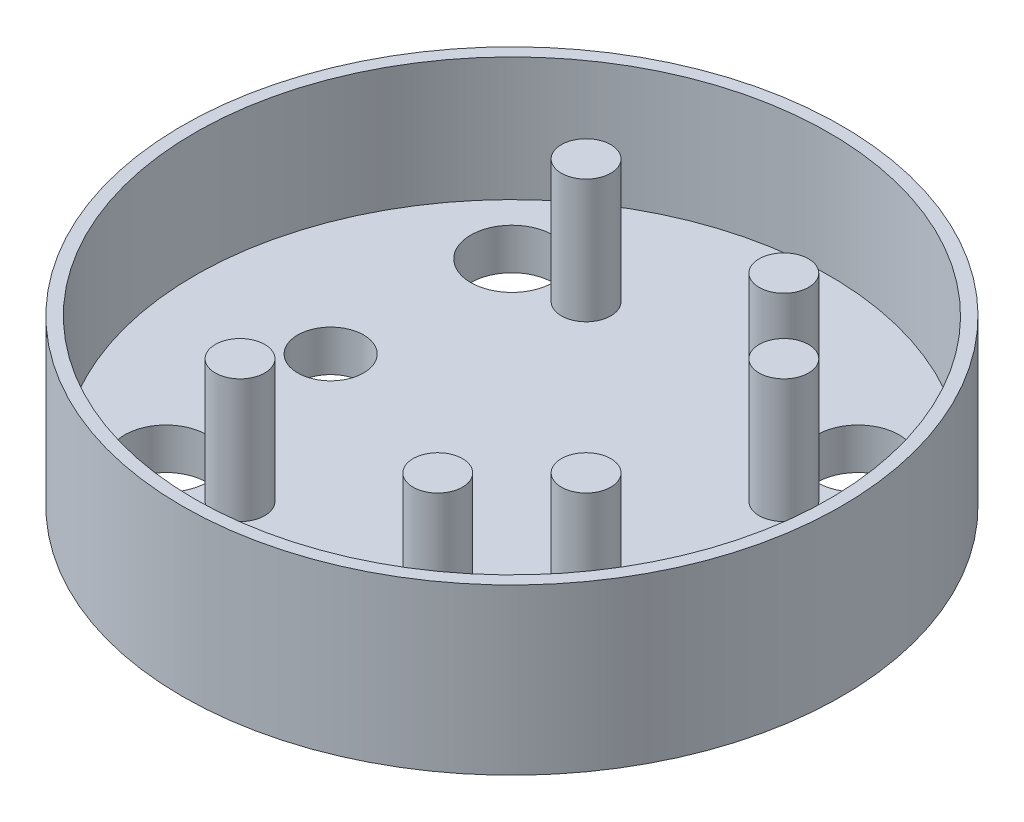
from build123d import *

# Parameters (mm, degrees)
SKETCH1_R           = 40
SKETCH1_R_2         = 5
BOSS_EXTRUDE1_DEPTH = 5
SKETCH2_R           = 40
SKETCH2_R_2         = 38.5
SKETCH2_R_3         = 3
BOSS_EXTRUDE2_DEPTH = 15
SKETCH5_R           = 4
CUT_EXTRUDE1_DEPTH  = 5


with BuildPart() as part:
    # Sketch1 → Boss-Extrude1 (new body)
    with BuildSketch(Plane(origin=(0, 0, 0), x_dir=(1, 0, 0), z_dir=(0, 1, 0))):
        with Locations(Location((0, 0, 0), (0, 0, 270))):
            Circle(SKETCH1_R)
        with Locations(Location((-21, 21, 0), (0, 0, 270))):
            Circle(SKETCH1_R_2, mode=Mode.SUBTRACT)
        with Locations(Location((-21, -21, 0), (0, 0, 270))):
            Circle(SKETCH1_R_2, mode=Mode.SUBTRACT)
        with Locations(Location((21, -21, 0), (0, 0, 270))):
            Circle(SKETCH1_R_2, mode=Mode.SUBTRACT)
        with Locations(Location((21, 21, 0), (0, 0, 270))):
            Circle(SKETCH1_R_2, mode=Mode.SUBTRACT)
    extrude(amount=BOSS_EXTRUDE1_DEPTH)

    # Sketch2 → Boss-Extrude2 (add)
    # profile 1 of 7: a face of its own
    with BuildSketch(Plane(origin=(0, 5, 0), x_dir=(1, 0, 0), z_dir=(0, 1, 0))):
        with Locations(Location((0, 0, 0), (0, 0, 270))):
            Circle(SKETCH2_R)
        with Locations(Location((0, 0, 0), (0, 0, 270))):
            Circle(SKETCH2_R_2, mode=Mode.SUBTRACT)
    # profile 2 of 7: a face of its own
    with BuildSketch(Plane(origin=(0, 5, 0), x_dir=(1, 0, 0), z_dir=(0, 1, 0))):
        with Locations(Location((-12, -21, 0), (0, 0, 270))):
            Circle(SKETCH2_R_3)
    # profile 3 of 7: a face of its own
    with BuildSketch(Plane(origin=(0, 5, 0), x_dir=(1, 0, 0), z_dir=(0, 1, 0))):
        with Locations(Location((12, -21, 0), (0, 0, 270))):
            Circle(SKETCH2_R_3)
    # profile 4 of 7: a face of its own
    with BuildSketch(Plane(origin=(0, 5, 0), x_dir=(1, 0, 0), z_dir=(0, 1, 0))):
        with Locations(Location((21, -12, 0), (0, 0, 270))):
            Circle(SKETCH2_R_3)
    # profile 5 of 7: a face of its own
    with BuildSketch(Plane(origin=(0, 5, 0), x_dir=(1, 0, 0), z_dir=(0, 1, 0))):
        with Locations(Location((21, 12, 0), (0, 0, 270))):
            Circle(SKETCH2_R_3)
    # profile 6 of 7: a face of its own
    with BuildSketch(Plane(origin=(0, 5, 0), x_dir=(1, 0, 0), z_dir=(0, 1, 0))):
        with Locations(Location((12, 21, 0), (0, 0, 270))):
            Circle(SKETCH2_R_3)
    # profile 7 of 7: a face of its own
    with BuildSketch(Plane(origin=(0, 5, 0), x_dir=(1, 0, 0), z_dir=(0, 1, 0))):
        with Locations(Location((-12, 21, 0), (0, 0, 270))):
            Circle(SKETCH2_R_3)
    extrude(amount=BOSS_EXTRUDE2_DEPTH)

    # Sketch5 → Cut-Extrude1 (cut)
    with BuildSketch(Plane.XZ):
        with Locations(Location((-22, 0, 0), (0, 0, 270))):
            Circle(SKETCH5_R)
    extrude(amount=-CUT_EXTRUDE1_DEPTH, mode=Mode.SUBTRACT)


solid = part.part
